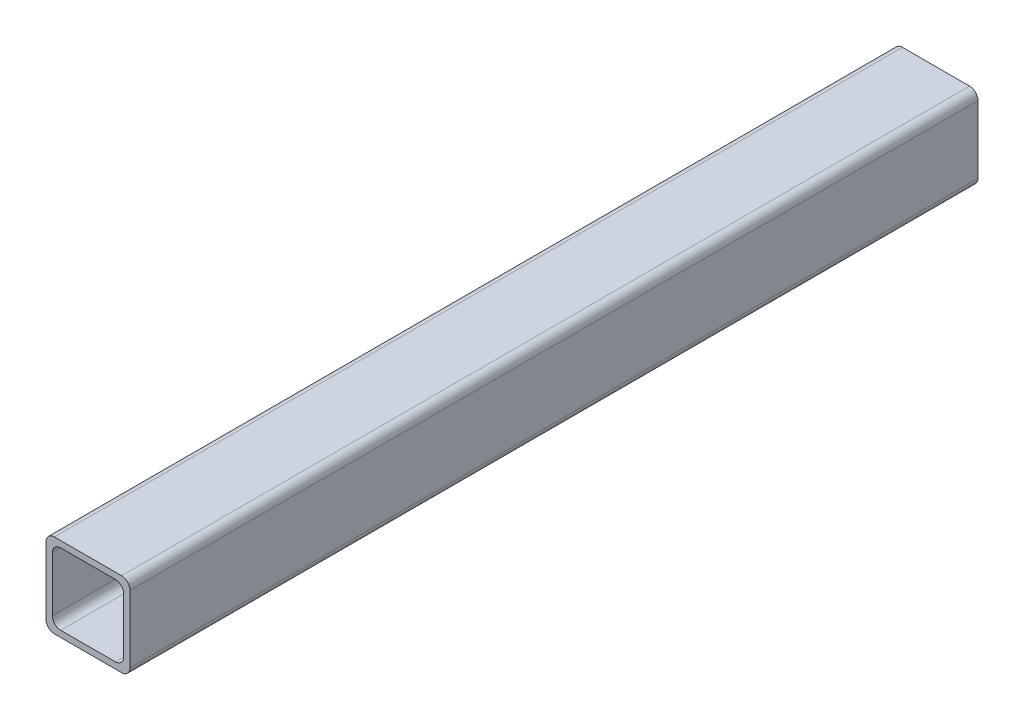
from build123d import *

# Parameters (mm, degrees)
SKETCH1_W           = 20
SKETCH1_H           = 20
SKETCH1_W_2         = 17
SKETCH1_H_2         = 17
BOSS_EXTRUDE1_DEPTH = 202
FILLET1_R           = 2


with BuildPart() as part:
    # Sketch1 → Boss-Extrude1 (new body)
    with BuildSketch(Plane.XY):
        Rectangle(SKETCH1_W, SKETCH1_H)
        Rectangle(SKETCH1_W_2, SKETCH1_H_2, mode=Mode.SUBTRACT)
    extrude(amount=BOSS_EXTRUDE1_DEPTH)

    # Fillet1
    fillet1_edges = [part.edges().sort_by_distance(p)[0] for p in [
        (-8.5, 8.5, 101),
        (-8.5, -8.5, 101),
        (8.5, -8.5, 101),
        (8.5, 8.5, 101),
        (10, -10, 101),
        (-10, -10, 101),
        (-10, 10, 101),
        (10, 10, 101),
    ]]
    fillet(fillet1_edges, radius=FILLET1_R)


solid = part.part
